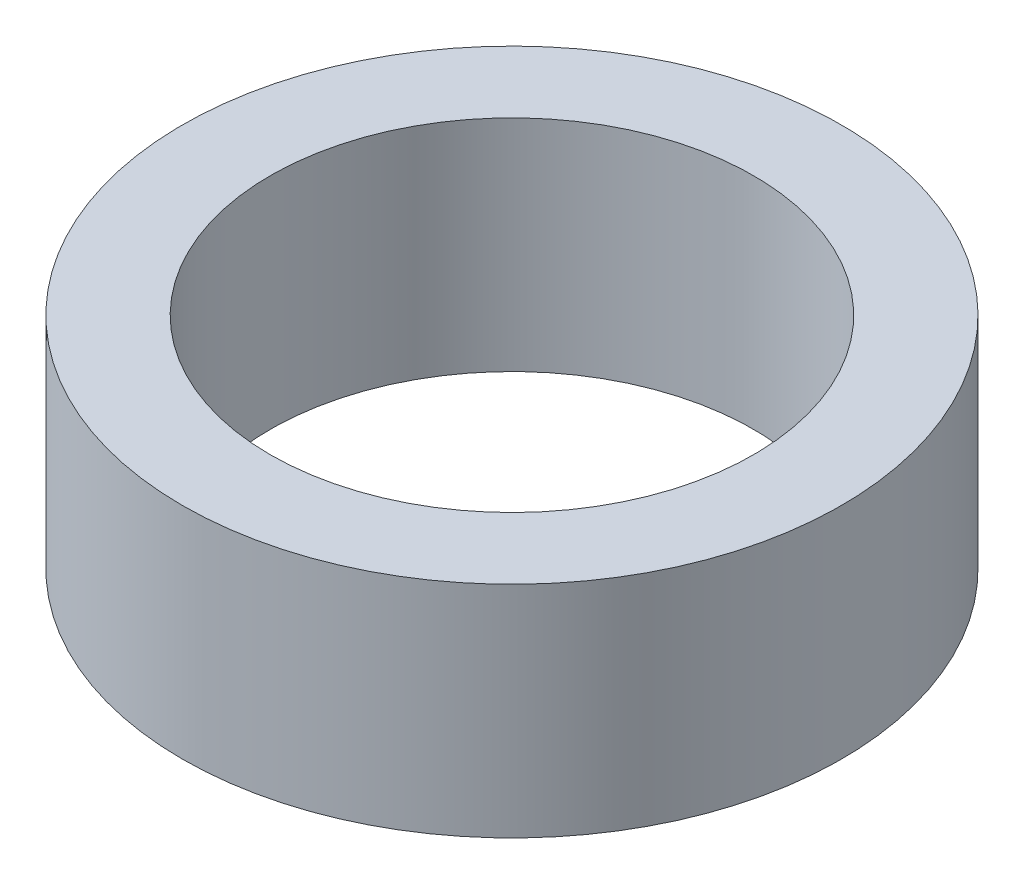
from build123d import *

# Parameters (mm, degrees)
SKETCH_1_R      = 3.75
SKETCH_1_R_2    = 2.75
EXTRUDE_1_DEPTH = 2.5


with BuildPart() as part:
    # 草图1 → 凸台-拉伸1 (new body)
    with BuildSketch(Plane(origin=(0, 0, 0), x_dir=(1, 0, 0), z_dir=(0, 1, 0))):
        with Locations(Location((0, 0, 0), (0, 0, 270))):
            Circle(SKETCH_1_R)
        with Locations(Location((0, 0, 0), (0, 0, 270))):
            Circle(SKETCH_1_R_2, mode=Mode.SUBTRACT)
    extrude(amount=EXTRUDE_1_DEPTH)


solid = part.part
